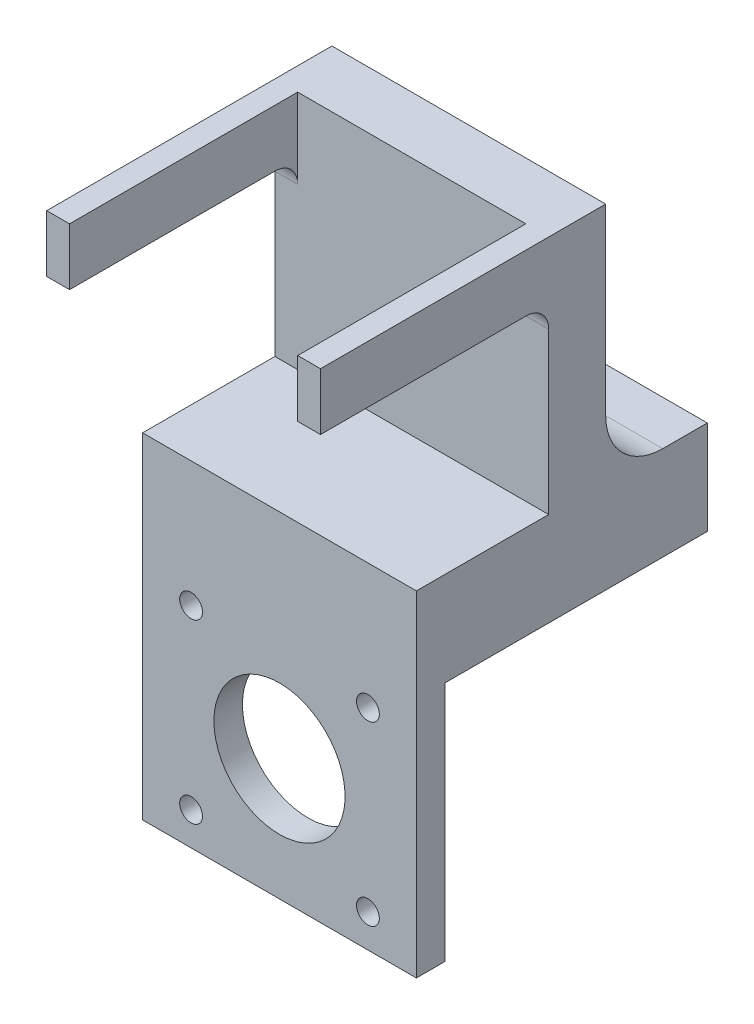
from build123d import *

# Parameters (mm, degrees)
SKETCH1_W           = 48
SKETCH1_H           = 53
BOSS_EXTRUDE1_DEPTH = 10
SKETCH2_W           = 48
SKETCH2_H           = 5.616325
BOSS_EXTRUDE2_DEPTH = 33.1917878
SKETCH4_W           = 4
SKETCH4_H           = 10
BOSS_EXTRUDE4_DEPTH = 40
SKETCH5_W           = 48
SKETCH5_H           = 10.8609375
BOSS_EXTRUDE5_DEPTH = 23.1917878
SKETCH6_W           = 48
SKETCH6_H           = 5
BOSS_EXTRUDE6_DEPTH = 42.3
SKETCH7_W           = 12.8082122
SKETCH7_H           = 16.4772625
BOSS_EXTRUDE7_DEPTH = 48
CUT_EXTRUDE1_REACH  = 84.426
SKETCH8_R           = 11.5
SKETCH8_R_2         = 2
FILLET1_R           = 10
FILLET2_R           = 4
SKETCH9_W           = 5
SKETCH9_H           = 16.4772625
BOSS_EXTRUDE9_DEPTH = 48


with BuildPart() as part:
    # Sketch1 → Boss-Extrude1 (new body)
    with BuildSketch(Plane.XY):
        with Locations((24, 26.5)):
            Rectangle(SKETCH1_W, SKETCH1_H)
    extrude(amount=BOSS_EXTRUDE1_DEPTH)

    # Sketch2 → Boss-Extrude2 (add)
    with BuildSketch(Plane(origin=(0, 0, 0), x_dir=(-1, 0, 0), z_dir=(0, 0, -1))):
        with Locations((-24, -2.8081625)):
            Rectangle(SKETCH2_W, SKETCH2_H)
    extrude(amount=-BOSS_EXTRUDE2_DEPTH)

    # Sketch4 → Boss-Extrude4 (add)
    with BuildSketch(Plane.XY.offset(10)):
        with Locations((2, 48)):
            Rectangle(SKETCH4_W, SKETCH4_H)
        with Locations((46, 48)):
            Rectangle(SKETCH4_W, SKETCH4_H)
    extrude(amount=BOSS_EXTRUDE4_DEPTH)

    # Sketch5 → Boss-Extrude5 (add)
    with BuildSketch(Plane.XY.offset(10)):
        with Locations((24, 5.43046875)):
            Rectangle(SKETCH5_W, SKETCH5_H)
    extrude(amount=BOSS_EXTRUDE5_DEPTH)

    # Sketch6 → Boss-Extrude6 (add)
    with BuildSketch(Plane.XZ.offset(5.616325)):
        with Locations((24, 30.6917878)):
            Rectangle(SKETCH6_W, SKETCH6_H)
    extrude(amount=BOSS_EXTRUDE6_DEPTH)

    # Sketch7 → Boss-Extrude7 (add)
    with BuildSketch(Plane.ZY):
        with Locations((-6.4041061, 2.62230625)):
            Rectangle(SKETCH7_W, SKETCH7_H)
    extrude(amount=-BOSS_EXTRUDE7_DEPTH)

    # Sketch8 → Cut-Extrude1 (cut, up to next)
    with BuildSketch(Plane(origin=(0, 0, 28.1917878), x_dir=(-1, 0, 0), z_dir=(0, 0, -1)), mode=Mode.PRIVATE) as cut_extrude1_sk1:
        with Locations((-24, -26.616325)):
            Circle(SKETCH8_R)
    cut_extrude1_tool1 = extrude(cut_extrude1_sk1.sketch, amount=-CUT_EXTRUDE1_REACH, mode=Mode.PRIVATE) & part.part
    # Sketch8 → Cut-Extrude1 (cut, up to next)
    with BuildSketch(Plane(origin=(0, 0, 28.1917878), x_dir=(-1, 0, 0), z_dir=(0, 0, -1)), mode=Mode.PRIVATE) as cut_extrude1_sk2:
        with Locations((-39.5, -11.116325)):
            Circle(SKETCH8_R_2)
    cut_extrude1_tool2 = extrude(cut_extrude1_sk2.sketch, amount=-CUT_EXTRUDE1_REACH, mode=Mode.PRIVATE) & part.part
    # Sketch8 → Cut-Extrude1 (cut, up to next)
    with BuildSketch(Plane(origin=(0, 0, 28.1917878), x_dir=(-1, 0, 0), z_dir=(0, 0, -1)), mode=Mode.PRIVATE) as cut_extrude1_sk3:
        with Locations((-39.5, -42.116325)):
            Circle(SKETCH8_R_2)
    cut_extrude1_tool3 = extrude(cut_extrude1_sk3.sketch, amount=-CUT_EXTRUDE1_REACH, mode=Mode.PRIVATE) & part.part
    # Sketch8 → Cut-Extrude1 (cut, up to next)
    with BuildSketch(Plane(origin=(0, 0, 28.1917878), x_dir=(-1, 0, 0), z_dir=(0, 0, -1)), mode=Mode.PRIVATE) as cut_extrude1_sk4:
        with Locations((-8.5, -11.116325)):
            Circle(SKETCH8_R_2)
    cut_extrude1_tool4 = extrude(cut_extrude1_sk4.sketch, amount=-CUT_EXTRUDE1_REACH, mode=Mode.PRIVATE) & part.part
    # Sketch8 → Cut-Extrude1 (cut, up to next)
    with BuildSketch(Plane(origin=(0, 0, 28.1917878), x_dir=(-1, 0, 0), z_dir=(0, 0, -1)), mode=Mode.PRIVATE) as cut_extrude1_sk5:
        with Locations((-8.5, -42.116325)):
            Circle(SKETCH8_R_2)
    cut_extrude1_tool5 = extrude(cut_extrude1_sk5.sketch, amount=-CUT_EXTRUDE1_REACH, mode=Mode.PRIVATE) & part.part
    add(cut_extrude1_tool1.solids().sort_by_distance((24, -26.616325, 28.191788))[0], mode=Mode.SUBTRACT)
    add(cut_extrude1_tool2.solids().sort_by_distance((39.5, -11.116325, 28.191788))[0], mode=Mode.SUBTRACT)
    add(cut_extrude1_tool3.solids().sort_by_distance((39.5, -42.116325, 28.191788))[0], mode=Mode.SUBTRACT)
    add(cut_extrude1_tool4.solids().sort_by_distance((8.5, -11.116325, 28.191788))[0], mode=Mode.SUBTRACT)
    add(cut_extrude1_tool5.solids().sort_by_distance((8.5, -42.116325, 28.191788))[0], mode=Mode.SUBTRACT)

    # Fillet1
    fillet1_edges = [part.edges().sort_by_distance(p)[0] for p in [
        (24, 10.8609375, 0),
    ]]
    fillet(fillet1_edges, radius=FILLET1_R)

    # Fillet2
    fillet2_edges = [part.edges().sort_by_distance(p)[0] for p in [
        (2, 43, 10),
        (46, 43, 10),
    ]]
    fillet(fillet2_edges, radius=FILLET2_R)

    # Sketch9 → Boss-Extrude9 (add)
    with BuildSketch(Plane(origin=(48, 0, 0), x_dir=(0, 0, -1), z_dir=(1, 0, 0))):
        with Locations((15.3082122, 2.62230625)):
            Rectangle(SKETCH9_W, SKETCH9_H)
    extrude(amount=-BOSS_EXTRUDE9_DEPTH)


solid = part.part
